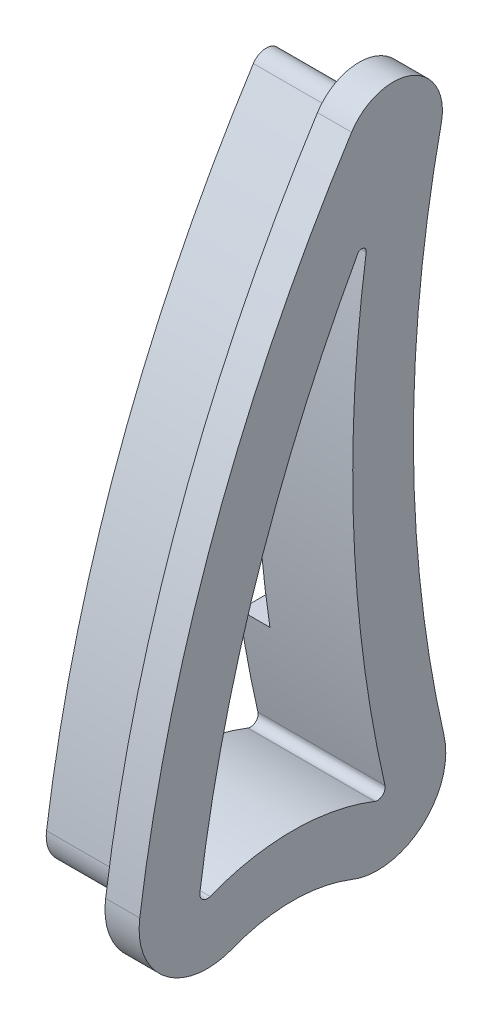
from build123d import *

# Parameters (mm, degrees)
BOSS_EXTRUDE1_DEPTH = 76.2
SKETCH2_W           = 6.985
SKETCH2_H           = 9.525
CUT_EXTRUDE1_DEPTH  = 119.84173867
CUT_EXTRUDE2_DEPTH  = 119.84173867
CUT_EXTRUDE3_DEPTH  = 119.84173867
CUT_EXTRUDE4_DEPTH  = 5.08
CUT_EXTRUDE6_DEPTH  = 36.83
FILLET2_R           = 0.762
BOSS_EXTRUDE2_DEPTH = 15.5575
FILLET3_R           = 0.762
BOSS_EXTRUDE3_DEPTH = 5.715
CUT_EXTRUDE7_START  = 5.08
CUT_EXTRUDE7_DEPTH  = 5.08


with BuildPart() as part:
    # Sketch1 → Boss-Extrude1 (new body)
    with BuildSketch(Plane.XY):
        Polygon((-15.5575, 76.2), (15.5575, 76.2), (15.5575, -76.2), (7.845485509, -76.2), (9.525, -85.725), (-9.525, -85.725), (-7.845485509, -76.2), (-15.5575, -76.2), align=None)
    extrude(amount=BOSS_EXTRUDE1_DEPTH)

    # Sketch2 → Cut-Extrude1 (cut, through all)
    with BuildSketch(Plane(origin=(15.5575, 0, 0), x_dir=(0, 0, -1), z_dir=(1, 0, 0))):
        with Locations((-3.4925, -80.9625)):
            Rectangle(SKETCH2_W, SKETCH2_H)
    extrude(amount=-CUT_EXTRUDE1_DEPTH, mode=Mode.SUBTRACT)

    # Sketch3 → Cut-Extrude2 (cut, through all)
    with BuildSketch(Plane(origin=(15.5575, 0, 0), x_dir=(0, 0, -1), z_dir=(1, 0, 0))):
        with BuildLine():
            Line((-76.2, -85.725), (-76.2, -76.2))
            Line((-76.2, -76.2), (-76.2, 76.2))
            Line((-76.2, 76.2), (-15.907508532, 76.2))
            ThreePointArc((-15.907508532, 76.2), (-60.637785123, 0.667838465), (-76.2, -85.725))
        make_face()
        with BuildLine():
            Line((0, -76.2), (0, 63.796446855))
            ThreePointArc((0, 63.796446855), (-12.85182234, -6.201776572), (0, -76.2))
        make_face()
    extrude(amount=-CUT_EXTRUDE2_DEPTH, mode=Mode.SUBTRACT)

    # Sketch6 → Cut-Extrude3 (cut, through all)
    with BuildSketch(Plane(origin=(15.5575, 0, 0), x_dir=(0, 0, -1), z_dir=(1, 0, 0))):
        with BuildLine():
            ThreePointArc((-26.004408293, 40.411420838), (-22.895186728, 41.391641282), (-21.382101704, 38.503966686))
            ThreePointArc((-21.382101704, 38.503966686), (-26.183938112, -7.303408092), (-20.902654077, -53.057984431))
            ThreePointArc((-20.902654077, -53.057984431), (-22.751384732, -58.666992363), (-28.575599954, -59.645405394))
            ThreePointArc((-28.575599954, -59.645405394), (-40.728748793, -57.329846812), (-52.881897632, -59.645405394))
            ThreePointArc((-52.881897632, -59.645405394), (-58.514495406, -58.82440967), (-60.644203683, -53.545722871))
            ThreePointArc((-60.644203683, -53.545722871), (-48.403726567, -4.694487773), (-26.004408293, 40.411420838))
        make_face()
    extrude(amount=-CUT_EXTRUDE3_DEPTH, mode=Mode.SUBTRACT)

    # Sketch7 → Cut-Extrude4 (cut, symmetric)
    with BuildSketch(Plane(origin=(0, 0, 0), x_dir=(0, 0, -1), z_dir=(1, 0, 0))):
        with BuildLine():
            Line((-24.910956945, 16.933040929), (-11.489033389, 16.933040929))
            ThreePointArc((-11.489033389, 16.933040929), (-12.80682615, -10.412600109), (-10.321792572, -37.676959071))
            Line((-10.321792572, -37.676959071), (-23.81904356, -37.676959071))
            ThreePointArc((-23.81904356, -37.676959071), (-26.144779891, -10.407545323), (-24.910956945, 16.933040929))
        make_face()
    extrude(amount=CUT_EXTRUDE4_DEPTH, both=True, mode=Mode.SUBTRACT)

    # Sketch10 → Cut-Extrude6 (cut, symmetric)
    with BuildSketch(Plane(origin=(15.5575, 76.2, 15.907508532), x_dir=(-1, 0, 0), z_dir=(0, -0.6148991463064188, -0.7886057569353888))):
        Polygon((0, 9.781513416), (8.255, 9.781513416), (0, -2.283486584), align=None)
        Polygon((31.115, 9.781513416), (31.115, -2.283486584), (22.86, 9.781513416), align=None)
    extrude(amount=CUT_EXTRUDE6_DEPTH, both=True, mode=Mode.SUBTRACT)

    # Fillet2
    fillet2_edges = [part.edges().sort_by_distance(p)[0] for p in [
        (-15.5575, 4.051612744, 59.349592349),
        (-14.77625063, 75.333628159, 16.653053168),
        (0, 76.2, 15.907508532),
        (15.5575, 4.051612744, 59.349592349),
        (14.77625063, 75.333628159, 16.653053168),
    ]]
    fillet(fillet2_edges, radius=FILLET2_R)


with BuildPart() as body_2:
    # Sketch11 → Boss-Extrude2 (new body)
    with BuildSketch(Plane(origin=(15.5575, 0, 0), x_dir=(0, 0, -1), z_dir=(1, 0, 0))):
        with BuildLine():
            ThreePointArc((-60.644203683, -53.545722871), (-58.514495406, -58.82440967), (-52.881897632, -59.645405394))
            ThreePointArc((-52.881897632, -59.645405394), (-40.728748793, -57.329846812), (-28.575599954, -59.645405394))
            ThreePointArc((-28.575599954, -59.645405394), (-22.751384732, -58.666992363), (-20.902654077, -53.057984431))
            ThreePointArc((-20.902654077, -53.057984431), (-26.183938112, -7.303408092), (-21.382101704, 38.503966686))
            ThreePointArc((-21.382101704, 38.503966686), (-22.895186728, 41.391641282), (-26.004408293, 40.411420838))
            ThreePointArc((-26.004408293, 40.411420838), (-48.403726567, -4.694487773), (-60.644203683, -53.545722871))
        make_face()
        with BuildLine():
            ThreePointArc((-56.241344514, -54.156342338), (-55.768076008, -55.329383849), (-54.516387613, -55.511827344))
            ThreePointArc((-54.516387613, -55.511827344), (-40.728748793, -52.884846812), (-26.941109972, -55.511827344))
            ThreePointArc((-26.941109972, -55.511827344), (-25.646839923, -55.294402226), (-25.236010888, -54.047956018))
            ThreePointArc((-25.236010888, -54.047956018), (-30.535382276, -12.638178349), (-27.725713329, 29.014658098))
            ThreePointArc((-27.725713329, 29.014658098), (-45.998284717, -11.194361196), (-56.241344514, -54.156342338))
        make_face(mode=Mode.SUBTRACT)
    extrude(amount=-BOSS_EXTRUDE2_DEPTH)

    # Fillet3
    fillet3_edges = [body_2.edges().sort_by_distance(p)[0] for p in [
        (7.77875, 29.014658098, 27.725713329),
    ]]
    fillet(fillet3_edges, radius=FILLET3_R)

    # Sketch13 → Cut-Extrude7 (cut)
    with BuildSketch(Plane(origin=(0, 0, 0), x_dir=(0, 0, -1), z_dir=(1, 0, 0)).offset(CUT_EXTRUDE7_START)):
        with BuildLine():
            Line((-11.489033389, 16.933040929), (-29.382511575, 16.933040929))
            ThreePointArc((-29.382511575, 16.933040929), (-30.590678841, -10.406069442), (-28.313574796, -37.676959071))
            Line((-28.313574796, -37.676959071), (-10.321792572, -37.676959071))
            ThreePointArc((-10.321792572, -37.676959071), (-12.80682615, -10.412600109), (-11.489033389, 16.933040929))
        make_face()
    extrude(amount=-CUT_EXTRUDE7_DEPTH, mode=Mode.SUBTRACT)


with BuildPart() as body_3:
    # Sketch12 → Boss-Extrude3 (new body)
    with BuildSketch(Plane(origin=(15.5575, 0, 0), x_dir=(0, 0, -1), z_dir=(1, 0, 0))):
        with BuildLine():
            ThreePointArc((-30.820115457, 43.488788141), (-53.765912925, -2.717575417), (-66.305022615, -52.760640699))
            ThreePointArc((-66.305022615, -52.760640699), (-62.045606061, -63.318014297), (-50.780410512, -64.960005745))
            ThreePointArc((-50.780410512, -64.960005745), (-40.728748793, -63.044846812), (-30.677087073, -64.960005745))
            ThreePointArc((-30.677087073, -64.960005745), (-19.028656629, -63.003179683), (-15.331195319, -51.785163819))
            ThreePointArc((-15.331195319, -51.785163819), (-20.469016461, -7.273482937), (-15.797619041, 37.289562147))
            ThreePointArc((-15.797619041, 37.289562147), (-20.715145369, 46.674504585), (-30.820115457, 43.488788141))
        make_face()
        with BuildLine():
            ThreePointArc((-56.241344514, -54.156342338), (-55.768076008, -55.329383849), (-54.516387613, -55.511827344))
            ThreePointArc((-54.516387613, -55.511827344), (-40.728748793, -52.884846812), (-26.941109972, -55.511827344))
            ThreePointArc((-26.941109972, -55.511827344), (-25.646839923, -55.294402226), (-25.236010888, -54.047956018))
            ThreePointArc((-25.236010888, -54.047956018), (-30.462301973, -14.734514328), (-28.372972672, 24.869721798))
            ThreePointArc((-28.372972672, 24.869721798), (-28.883789244, 25.702089435), (-29.794040566, 25.34823638))
            ThreePointArc((-29.794040566, 25.34823638), (-46.671799333, -13.18850949), (-56.241344514, -54.156342338))
        make_face(mode=Mode.SUBTRACT)
    extrude(amount=BOSS_EXTRUDE3_DEPTH)


with BuildPart() as body_2_1:
    add(body_2.part)

    # Combine1: union body 3
    add(body_3.part)


solid = body_2_1.part
